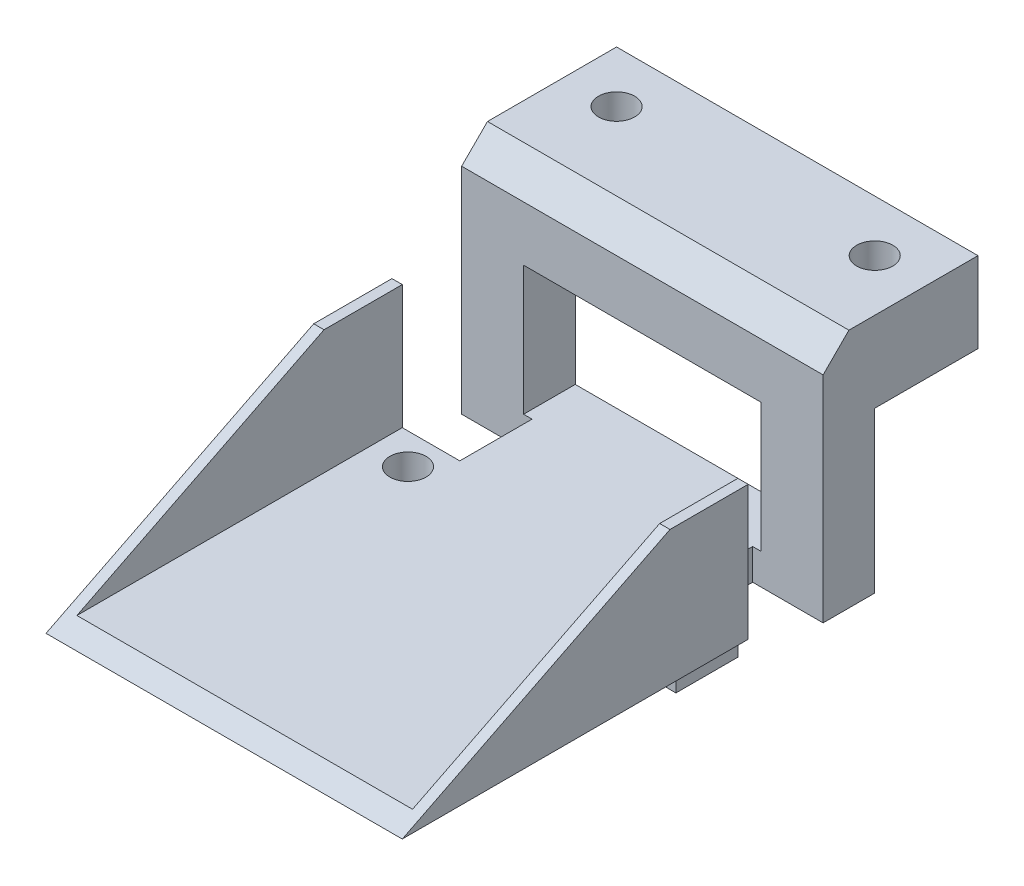
from build123d import *

# Parameters (mm, degrees)
SKETCH1_W           = 32.5
SKETCH1_H           = 6
SKETCH1_R           = 1.75
BOSS_EXTRUDE1_DEPTH = 3
SKETCH2_W           = 21.36
SKETCH2_H           = 12
BOSS_EXTRUDE2_DEPTH = 3
SKETCH3_W           = 35
SKETCH3_H           = 5
BOSS_EXTRUDE3_DEPTH = 3
SKETCH4_W           = 6
SKETCH4_H           = 5
BOSS_EXTRUDE4_DEPTH = 12.5
SKETCH5_W           = 35
SKETCH5_H           = 15
BOSS_EXTRUDE5_DEPTH = 7.8
CHAMFER1_SIZE       = 2.5
SKETCH6_R           = 1.75
CUT_EXTRUDE1_DEPTH  = 35.22718218
BOSS_EXTRUDE6_DEPTH = 1
SKETCH8_W           = 32.5
SKETCH8_H           = 1
BOSS_EXTRUDE7_DEPTH = 27.5
CUT_EXTRUDE2_DEPTH  = 33.5
CUT_EXTRUDE3_DEPTH  = 52.775500963


with BuildPart() as part:
    # Sketch1 → Boss-Extrude1 (new body)
    with BuildSketch(Plane(origin=(0, 0, 0), x_dir=(1, 0, 0), z_dir=(0, 1, 0))):
        Rectangle(SKETCH1_W, SKETCH1_H)
        with Locations(Location((-12.7, 0, 0), (0, 0, 270))):
            Circle(SKETCH1_R, mode=Mode.SUBTRACT)
        with Locations(Location((12.7, 0, 0), (0, 0, 90))):
            Circle(SKETCH1_R, mode=Mode.SUBTRACT)
    extrude(amount=BOSS_EXTRUDE1_DEPTH)

    # Sketch2 → Boss-Extrude2 (add)
    with BuildSketch(Plane.XZ):
        with Locations((0, -9)):
            Rectangle(SKETCH2_W, SKETCH2_H)
    extrude(amount=-BOSS_EXTRUDE2_DEPTH)

    # Sketch3 → Boss-Extrude3 (add)
    with BuildSketch(Plane.XZ):
        with Locations((0, -12.5)):
            Rectangle(SKETCH3_W, SKETCH3_H)
    extrude(amount=-BOSS_EXTRUDE3_DEPTH)

    # Sketch4 → Boss-Extrude4 (add)
    with BuildSketch(Plane(origin=(0, 3, 0), x_dir=(1, 0, 0), z_dir=(0, 1, 0))):
        with Locations((-14.5, 12.5)):
            Rectangle(SKETCH4_W, SKETCH4_H)
        with Locations((14.5, 12.5)):
            Rectangle(SKETCH4_W, SKETCH4_H)
    extrude(amount=BOSS_EXTRUDE4_DEPTH)

    # Sketch5 → Boss-Extrude5 (add)
    with BuildSketch(Plane(origin=(0, 15.5, 0), x_dir=(1, 0, 0), z_dir=(0, 1, 0))):
        with Locations((0, 17.5)):
            Rectangle(SKETCH5_W, SKETCH5_H)
    extrude(amount=BOSS_EXTRUDE5_DEPTH)

    # Chamfer1
    chamfer1_edges = [part.edges().sort_by_distance(p)[0] for p in [
        (0, 23.3, -10),
    ]]
    chamfer(chamfer1_edges, length=CHAMFER1_SIZE)

    # Sketch6 → Cut-Extrude1 (cut, through all)
    with BuildSketch(Plane.XZ.offset(-15.5)):
        with Locations(Location((-12.5, -20, 0), (0, 0, 270))):
            Circle(SKETCH6_R)
        with Locations(Location((12.5, -20, 0), (0, 0, 90))):
            Circle(SKETCH6_R)
    extrude(amount=-CUT_EXTRUDE1_DEPTH, mode=Mode.SUBTRACT)

    # Sketch7 → Boss-Extrude6 (add)
    with BuildSketch(Plane.ZY.offset(16.25)):
        Polygon((-3, 2), (-3, 18.8), (30.5, 2), align=None)
    boss_extrude6 = extrude(amount=BOSS_EXTRUDE6_DEPTH)

    # Mirror1: Boss-Extrude6 across plane
    add(boss_extrude6.mirror(Plane(origin=(0, 0, 0), x_dir=(0, 0, 1), z_dir=(1, 0, 0))))

    # Sketch8 → Boss-Extrude7 (add)
    with BuildSketch(Plane.XY.offset(3)):
        with Locations((0, 2.5)):
            Rectangle(SKETCH8_W, SKETCH8_H)
    extrude(amount=BOSS_EXTRUDE7_DEPTH)

    # Sketch9 → Cut-Extrude2 (cut)
    with BuildSketch(Plane(origin=(16.25, 0, 0), x_dir=(0, 0, -1), z_dir=(1, 0, 0))):
        Polygon((-30.5, 2), (-28.505952381, 3), (-30.5, 3), align=None)
    extrude(amount=-CUT_EXTRUDE2_DEPTH, mode=Mode.SUBTRACT)

    # Sketch10 → Cut-Extrude3 (cut, through all)
    with BuildSketch(Plane.ZY.offset(17.25)):
        Polygon((-3, 15), (4.577380952, 15), (-3, 18.8), align=None)
    extrude(amount=-CUT_EXTRUDE3_DEPTH, mode=Mode.SUBTRACT)


solid = part.part
